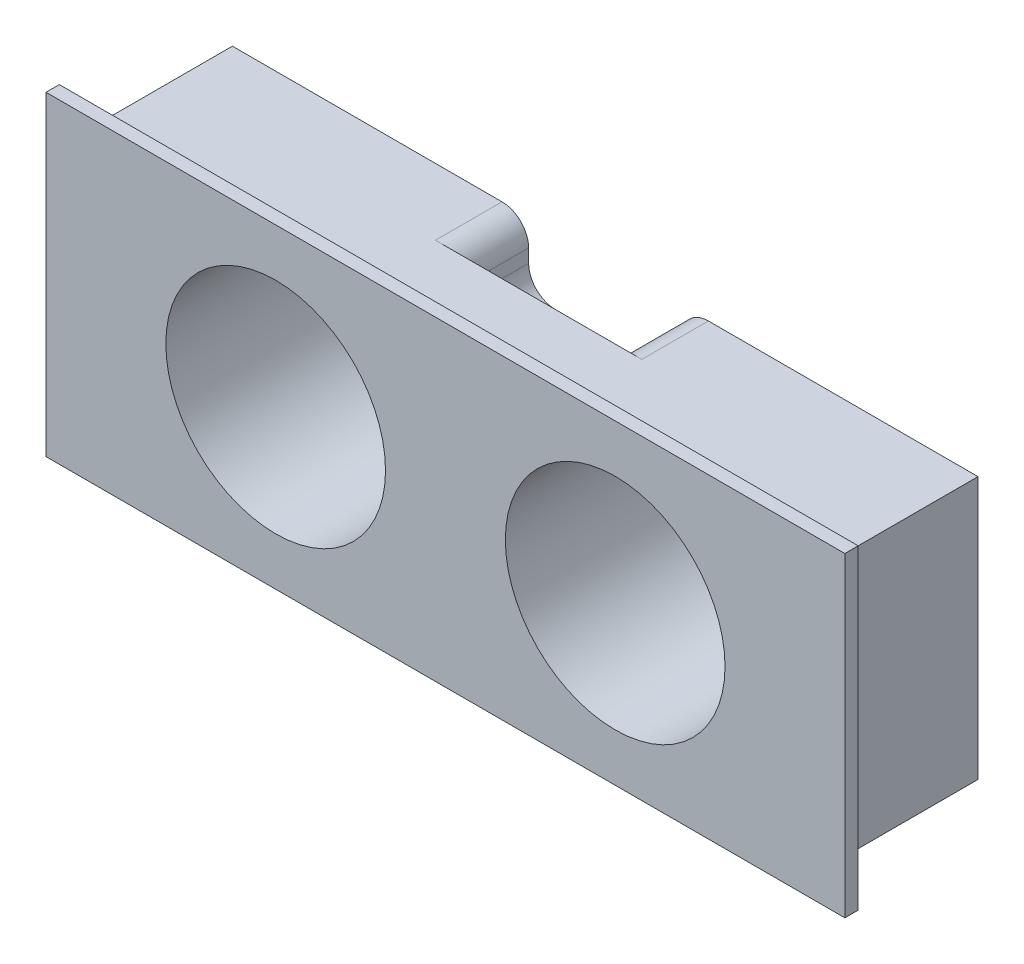
from build123d import *

# Parameters (mm, degrees)
SKETCH1_W           = 56
SKETCH1_H           = 19.7
BOSS_EXTRUDE2_DEPTH = 11
SKETCH3_W           = 60
SKETCH3_H           = 23.7
BOSS_EXTRUDE3_DEPTH = 1
SKETCH4_R           = 8.25
CUT_EXTRUDE1_DEPTH  = 35.415439849
CUT_EXTRUDE2_DEPTH  = 5
FILLET1_R           = 2
CUT_EXTRUDE3_DEPTH  = 5
FILLET2_R           = 2


with BuildPart() as part:
    # Sketch1 → Boss-Extrude2 (new body)
    with BuildSketch(Plane.XY):
        Rectangle(SKETCH1_W, SKETCH1_H)
    extrude(amount=BOSS_EXTRUDE2_DEPTH)

    # Sketch3 → Boss-Extrude3 (add)
    with BuildSketch(Plane.XY.offset(11)):
        Rectangle(SKETCH3_W, SKETCH3_H)
    extrude(amount=BOSS_EXTRUDE3_DEPTH)

    # Sketch4 → Cut-Extrude1 (cut, through all)
    with BuildSketch(Plane.XY.offset(12)):
        with Locations((-12.75, 0)):
            Circle(SKETCH4_R)
        with Locations((12.75, 0)):
            Circle(SKETCH4_R)
    extrude(amount=-CUT_EXTRUDE1_DEPTH, mode=Mode.SUBTRACT)

    # Sketch5 → Cut-Extrude2 (cut)
    with BuildSketch(Plane(origin=(0, 0, 0), x_dir=(-1, 0, 0), z_dir=(0, 0, -1))):
        with BuildLine():
            Line((-5.75, 9.85), (5.75, 9.85))
            Line((5.75, 9.85), (5.75, 6.85))
            ThreePointArc((5.75, 6.85), (5.164213562, 5.435786438), (3.75, 4.85))
            Line((3.75, 4.85), (-3.75, 4.85))
            ThreePointArc((-3.75, 4.85), (-5.164213562, 5.435786438), (-5.75, 6.85))
            Line((-5.75, 6.85), (-5.75, 9.85))
        make_face()
    extrude(amount=-CUT_EXTRUDE2_DEPTH, mode=Mode.SUBTRACT)

    # Fillet1
    fillet1_edges = [part.edges().sort_by_distance(p)[0] for p in [
        (5.75, 9.85, 2.5),
        (-5.75, 9.85, 2.5),
    ]]
    fillet(fillet1_edges, radius=FILLET1_R)

    # Sketch6 → Cut-Extrude3 (cut)
    with BuildSketch(Plane(origin=(0, 0, 0), x_dir=(-1, 0, 0), z_dir=(0, 0, -1))):
        with BuildLine():
            Line((-3.75, -4.85), (3.75, -4.85))
            ThreePointArc((3.75, -4.85), (5.164213562, -5.435786438), (5.75, -6.85))
            Line((5.75, -6.85), (5.75, -9.85))
            Line((5.75, -9.85), (-5.75, -9.85))
            Line((-5.75, -9.85), (-5.75, -6.85))
            ThreePointArc((-5.75, -6.85), (-5.164213562, -5.435786438), (-3.75, -4.85))
        make_face()
    extrude(amount=-CUT_EXTRUDE3_DEPTH, mode=Mode.SUBTRACT)

    # Fillet2
    fillet2_edges = [part.edges().sort_by_distance(p)[0] for p in [
        (-5.75, -9.85, 2.5),
        (5.75, -9.85, 2.5),
    ]]
    fillet(fillet2_edges, radius=FILLET2_R)


solid = part.part
